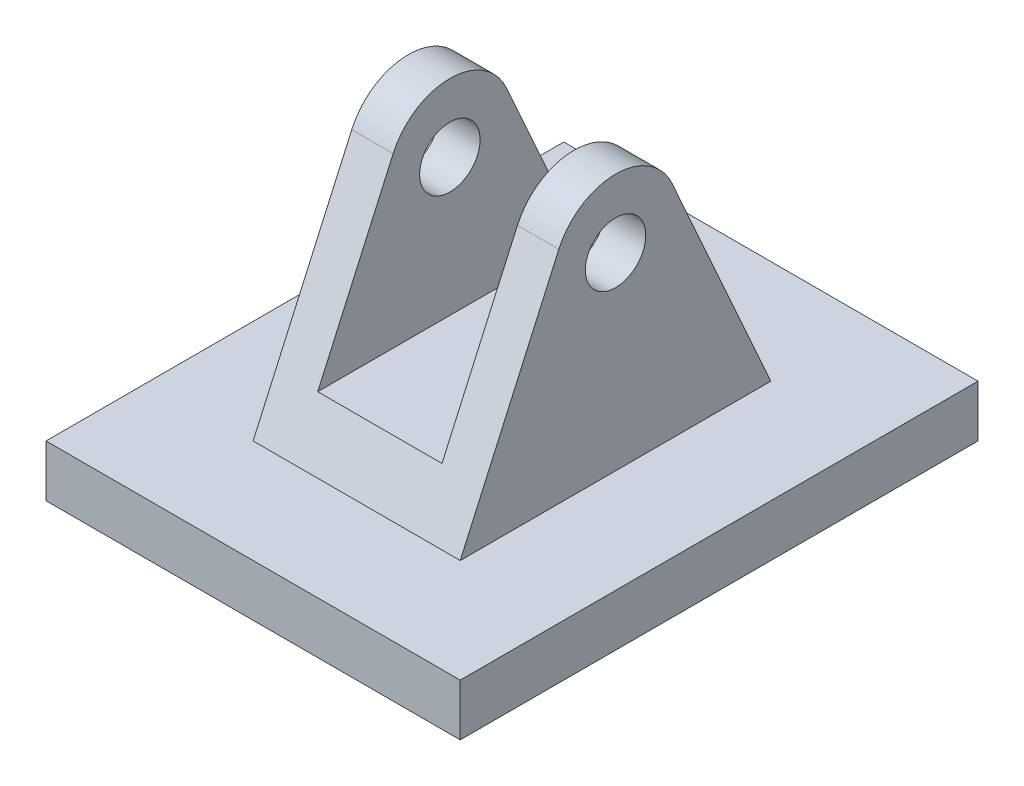
from build123d import *

# Parameters (mm, degrees)
SKETCH1_W                = 80
SKETCH1_H                = 100
BOSS_EXTRUDE1_DEPTH      = 10
BOSS_EXTRUDE2_DEPTH      = 60
BOSS_EXTRUDE2_DEPTH_BACK = 0.0001
MOVE_FACE1_BY            = 20
FILLET1_R                = 12
SKETCH8_R                = 5.841043822
CUT_EXTRUDE1_DEPTH       = 60
SKETCH10_W               = 24
SKETCH10_H               = 46.513085369
CUT_EXTRUDE2_DEPTH       = 200


with BuildPart() as part:
    # Sketch1 → Boss-Extrude1 (new body)
    with BuildSketch(Plane(origin=(0, 0, 0), x_dir=(1, 0, 0), z_dir=(0, 1, 0))):
        with Locations((40, -50)):
            Rectangle(SKETCH1_W, SKETCH1_H)
    extrude(amount=BOSS_EXTRUDE1_DEPTH)


with BuildPart() as body_2:
    # Sketch2 → Boss-Extrude2 (new, two sides: drawn at the far end of the back side and taken through both)
    with BuildSketch(Plane(origin=(0, 0, 0), x_dir=(0, 0, -1), z_dir=(1, 0, 0)).offset(-BOSS_EXTRUDE2_DEPTH_BACK)):
        Polygon((-80, 10), (-20, 10), (-50, 77), align=None)
    extrude(amount=BOSS_EXTRUDE2_DEPTH + BOSS_EXTRUDE2_DEPTH_BACK)

    # Move Face1: a face moved inward by 20.0
    extrude(body_2.faces().sort_by_distance((-0.0001, 32.333333333, 50))[0], amount=MOVE_FACE1_BY, dir=(1, 0, 0), mode=Mode.SUBTRACT)

    # Fillet1
    fillet1_edges = [body_2.edges().sort_by_distance(p)[0] for p in [
        (39.99995, 77, 50),
    ]]
    fillet(fillet1_edges, radius=FILLET1_R)

    # Sketch8 → Cut-Extrude1 (cut)
    with BuildSketch(Plane.ZY.offset(-19.9999)):
        with Locations((50, 46.483900052)):
            Circle(SKETCH8_R)
    extrude(amount=-CUT_EXTRUDE1_DEPTH, mode=Mode.SUBTRACT)

    # Sketch10 → Cut-Extrude2 (cut)
    with BuildSketch(Plane.XY):
        with Locations((40, 43.256542685)):
            Rectangle(SKETCH10_W, SKETCH10_H)
    extrude(amount=CUT_EXTRUDE2_DEPTH, mode=Mode.SUBTRACT)


solid = Compound([part.part, body_2.part])
